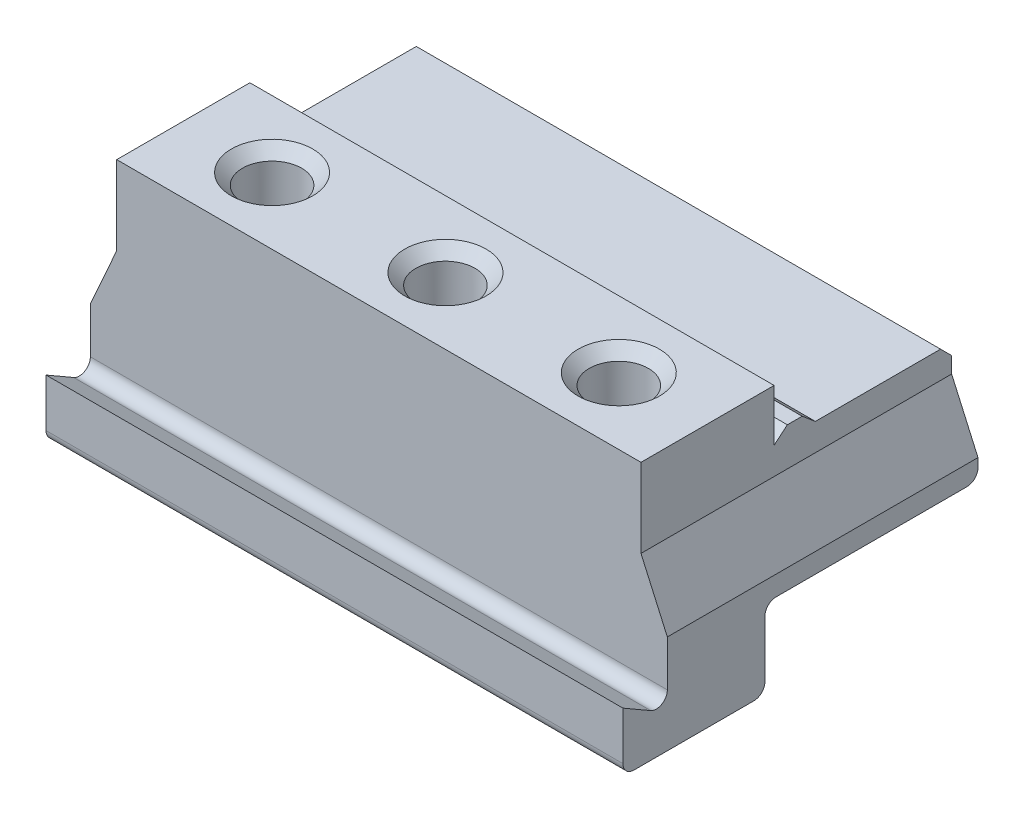
from build123d import *

# Parameters (mm, degrees)
BOSS_EXTRUDE1_DEPTH     = 78
CUT_EXTRUDE1_DEPTH      = 98.015462685
CUT_EXTRUDE1_DEPTH_BACK = 98.015462685
CUT_EXTRUDE2_DEPTH      = 98.015462685
CUT_EXTRUDE2_DEPTH_BACK = 10
SKETCH3_R               = 4
CHAMFER1_SIZE           = 1.5


with BuildPart() as part:
    # Sketch1 → Boss-Extrude1 (new body)
    with BuildSketch(Plane(origin=(0, 0, 0), x_dir=(0, 0, -1), z_dir=(1, 0, 0))):
        with BuildLine():
            Line((0, 8), (3.75, 5.834936491))
            ThreePointArc((3.75, 5.834936491), (5.25, 5.834936491), (6, 7.133974596))
            Line((6, 7.133974596), (6, 32))
            Line((6, 32), (24, 32))
            Line((24, 32), (24, 25))
            Line((24, 25), (25.787630389, 26.5))
            Line((25.787630389, 26.5), (27.787630389, 26.5))
            Line((27.787630389, 26.5), (29.575260778, 25))
            Line((29.575260778, 25), (46.5, 25))
            Line((46.5, 25), (48, 23.5))
            Line((48, 23.5), (48, 12.166666667))
            ThreePointArc((48, 12.166666667), (47.560660172, 11.106006495), (46.5, 10.666666667))
            Line((46.5, 10.666666667), (20.7, 10.666666667))
            ThreePointArc((20.7, 10.666666667), (19.639339828, 10.227326838), (19.2, 9.166666667))
            Line((19.2, 9.166666667), (19.2, 1.5))
            ThreePointArc((19.2, 1.5), (18.760660172, 0.439339828), (17.7, 0))
            Line((17.7, 0), (1.5, 0))
            ThreePointArc((1.5, 0), (0.439339828, 0.439339828), (0, 1.5))
            Line((0, 1.5), (0, 8))
        make_face()
    extrude(amount=BOSS_EXTRUDE1_DEPTH)

    # Sketch2 → Cut-Extrude1 (cut, two sides: drawn at the far end of the back side and taken through both)
    with BuildSketch(Plane.XY.offset(-CUT_EXTRUDE1_DEPTH_BACK)):
        Polygon((3.561829482, 32), (3.561829482, 21.333333333), (0, 13.333333333), (0, 32), align=None)
        Polygon((78, 13.333333333), (74.438170518, 21.333333333), (74.438170518, 32), (78, 32), align=None)
    extrude(amount=CUT_EXTRUDE1_DEPTH + CUT_EXTRUDE1_DEPTH_BACK, mode=Mode.SUBTRACT)

    # Sketch3 → Cut-Extrude2 (cut, two sides: drawn at the far end of the back side and taken through both)
    with BuildSketch(Plane(origin=(0, 32, 0), x_dir=(1, 0, 0), z_dir=(0, 1, 0)).offset(-CUT_EXTRUDE2_DEPTH_BACK)):
        with Locations(Location((15.561829482, 15, 0), (0, 0, 270))):
            Circle(SKETCH3_R)
        with Locations(Location((62.438170518, 15, 0), (0, 0, 270))):
            Circle(SKETCH3_R)
        with Locations(Location((39, 15, 0), (0, 0, 270))):
            Circle(SKETCH3_R)
    extrude(amount=CUT_EXTRUDE2_DEPTH + CUT_EXTRUDE2_DEPTH_BACK, mode=Mode.SUBTRACT)

    # Chamfer1
    chamfer1_edges = [part.edges().sort_by_distance(p)[0] for p in [
        (15.561829482, 32, -19),
        (62.438170518, 32, -19),
        (39, 32, -19),
    ]]
    chamfer(chamfer1_edges, length=CHAMFER1_SIZE)


solid = part.part
